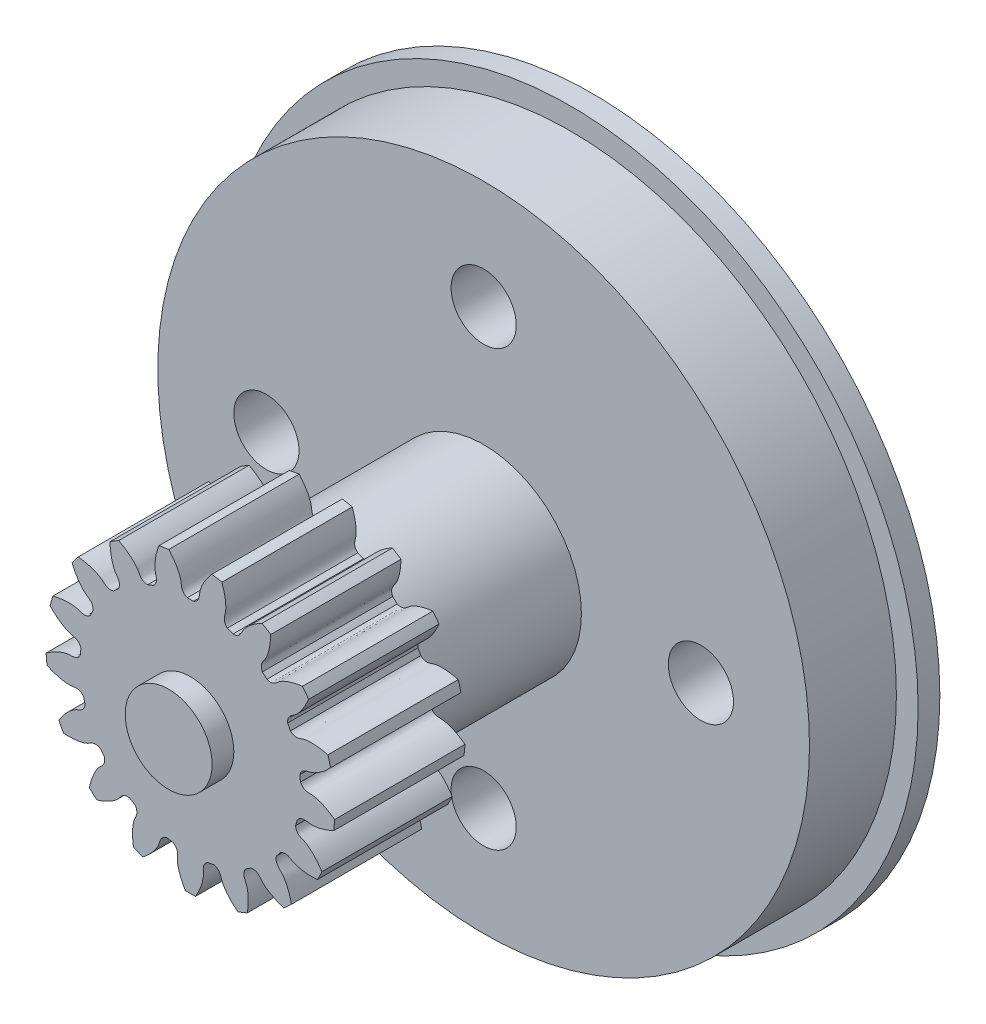
from build123d import *

# Parameters (mm, degrees)
SKETCH_1_R               = 6.65
EXTRUDE_1_DEPTH          = 6
CUT_EXTRUDE_1_DEPTH      = 6
PATTERN_CIRCULAR_1_COUNT = 17
SKETCH_5_R               = 1.5
CUT_EXTRUDE_2_DEPTH      = 27.348624304
SKETCH_6_R               = 2
EXTRUDE_2_DEPTH          = 1


with BuildPart() as part:
    # 草图1 → 凸台-拉伸1 (new body)
    with BuildSketch(Plane.XY):
        Circle(SKETCH_1_R)
    extrude(amount=EXTRUDE_1_DEPTH)

    # 草图2 → 切除-拉伸1 (cut)
    with BuildSketch(Plane.XY):
        with BuildLine():
            ThreePointArc((0.141185623, 5.07303574), (0, 5.075), (-0.141185623, 5.07303574))
            add(Edge.make_bspline(
                [(-0.141185623, 5.07303574), (-0.439515818, 5.197375415), (-0.396336765, 5.428369385), (-0.446813923, 5.645376896), (-0.451483014, 5.663805416), (-0.457112952, 5.68429352), (-0.463785413, 5.706809733), (-0.471584244, 5.731319554), (-0.480591356, 5.75778613), (-0.490887912, 5.786170076), (-0.502553878, 5.816429566), (-0.515668075, 5.848520345), (-0.530308075, 5.882395764), (-0.546550149, 5.918006809), (-0.564469203, 5.955302137), (-0.584138712, 5.994228111), (-0.605630663, 6.034728836), (-0.629015489, 6.0767462), (-0.654362013, 6.12021991), (-0.681737388, 6.165087537), (-0.71120704, 6.211284558), (-0.74283461, 6.258744399), (-0.776681898, 6.307398483), (-0.812808812, 6.357176277), (-0.851273308, 6.408005337), (-0.892131347, 6.459811365), (-0.935436834, 6.512518252), (-0.981241578, 6.566048138), (-1.029595236, 6.620321463), (-1.08054527, 6.675257018), (-1.134136899, 6.730772009), (-1.190413058, 6.786782109), (-1.249414352, 6.843201518), (-1.311179015, 6.899943022), (-1.375742871, 6.956918056), (-1.443139296, 7.014036763), (-1.513399177, 7.07120806), (-1.586550883, 7.128339697), (-1.662620224, 7.185338326), (-1.741630425, 7.242109564), (-1.823602093, 7.298558063), (-1.908553174, 7.354587572), (-2.027075144, 7.429401373), (-2.118603831, 7.48336818), (-2.180952083, 7.518503383)],
                knots=[0, 0, 0, 0, 0.193882922, 0.199023975, 0.204850501, 0.211362501, 0.218559975, 0.226442923, 0.235011345, 0.24426524, 0.254204608, 0.264829451, 0.276139767, 0.288135557, 0.300816821, 0.314183558, 0.328235769, 0.342973453, 0.358396612, 0.374505244, 0.39129935, 0.408778929, 0.426943982, 0.445794509, 0.46533051, 0.485551984, 0.506458932, 0.528051354, 0.550329249, 0.573292619, 0.596941461, 0.621275778, 0.646295568, 0.672000832, 0.69839157, 0.725467781, 0.753229466, 0.781676625, 0.810809257, 0.840627364, 0.871130943, 0.902319997, 0.934194524, 1, 1, 1, 1], degree=3))
            ThreePointArc((-2.180952083, 7.518503383), (0, 7.828438229), (2.180952083, 7.518503383))
            add(Edge.make_bspline(
                [(0.141185623, 5.07303574), (0.439515818, 5.197375415), (0.396336765, 5.428369385), (0.446813923, 5.645376896), (0.451483014, 5.663805416), (0.457112952, 5.68429352), (0.463785413, 5.706809733), (0.471584244, 5.731319554), (0.480591356, 5.75778613), (0.490887912, 5.786170076), (0.502553878, 5.816429566), (0.515668075, 5.848520345), (0.530308075, 5.882395764), (0.546550149, 5.918006809), (0.564469203, 5.955302137), (0.584138712, 5.994228111), (0.605630663, 6.034728836), (0.629015489, 6.0767462), (0.654362013, 6.12021991), (0.681737388, 6.165087537), (0.71120704, 6.211284558), (0.74283461, 6.258744399), (0.776681898, 6.307398483), (0.812808812, 6.357176277), (0.851273308, 6.408005337), (0.892131347, 6.459811365), (0.935436834, 6.512518252), (0.981241578, 6.566048138), (1.029595236, 6.620321463), (1.08054527, 6.675257018), (1.134136899, 6.730772009), (1.190413058, 6.786782109), (1.249414352, 6.843201518), (1.311179015, 6.899943022), (1.375742871, 6.956918056), (1.443139296, 7.014036763), (1.513399177, 7.07120806), (1.586550883, 7.128339697), (1.662620224, 7.185338326), (1.741630425, 7.242109564), (1.823602093, 7.298558063), (1.908553174, 7.354587572), (2.027075144, 7.429401373), (2.118603831, 7.48336818), (2.180952083, 7.518503383)],
                knots=[0, 0, 0, 0, 0.193882922, 0.199023975, 0.204850501, 0.211362501, 0.218559975, 0.226442923, 0.235011345, 0.24426524, 0.254204608, 0.264829451, 0.276139767, 0.288135557, 0.300816821, 0.314183558, 0.328235769, 0.342973453, 0.358396612, 0.374505244, 0.39129935, 0.408778929, 0.426943982, 0.445794509, 0.46533051, 0.485551984, 0.506458932, 0.528051354, 0.550329249, 0.573292619, 0.596941461, 0.621275778, 0.646295568, 0.672000832, 0.69839157, 0.725467781, 0.753229466, 0.781676625, 0.810809257, 0.840627364, 0.871130943, 0.902319997, 0.934194524, 1, 1, 1, 1], degree=3))
        make_face()
    cut_extrude_1 = extrude(amount=CUT_EXTRUDE_1_DEPTH, mode=Mode.SUBTRACT)

    # 阵列(圆周)1: 切除-拉伸1 ×17 about axis
    pattern_circular_1_axis = Axis((0, 0, -7.315), (0, 0, 1))
    for i in range(1, PATTERN_CIRCULAR_1_COUNT):
        add(cut_extrude_1.rotate(pattern_circular_1_axis, i * 360 / PATTERN_CIRCULAR_1_COUNT), mode=Mode.SUBTRACT)

    # 草图4 → 旋转1 (revolve)
    with BuildSketch(Plane(origin=(0, 0, 0), x_dir=(0, 0, -1), z_dir=(1, 0, 0))):
        Polygon((0, 0), (0, 4.5), (7.5, 4.5), (7.5, 15), (11.5, 15), (11.5, 16), (12.5, 16), (12.5, 3), (10, 3), (10, 0), align=None)
    revolve(axis=Axis((0, 0, 0), (0, 0, -1)))

    # 草图5 → 切除-拉伸2 (cut, through all)
    with BuildSketch(Plane.XY.offset(-7.5)):
        with Locations((10, 0)):
            Circle(SKETCH_5_R)
        with Locations((0, -10)):
            Circle(SKETCH_5_R)
        with Locations((-10, 0)):
            Circle(SKETCH_5_R)
        with Locations((0, 10)):
            Circle(SKETCH_5_R)
    extrude(amount=-CUT_EXTRUDE_2_DEPTH, mode=Mode.SUBTRACT)

    # 草图6 → 凸台-拉伸2 (add)
    with BuildSketch(Plane.XY.offset(6)):
        Circle(SKETCH_6_R)
    extrude(amount=EXTRUDE_2_DEPTH)


solid = part.part
